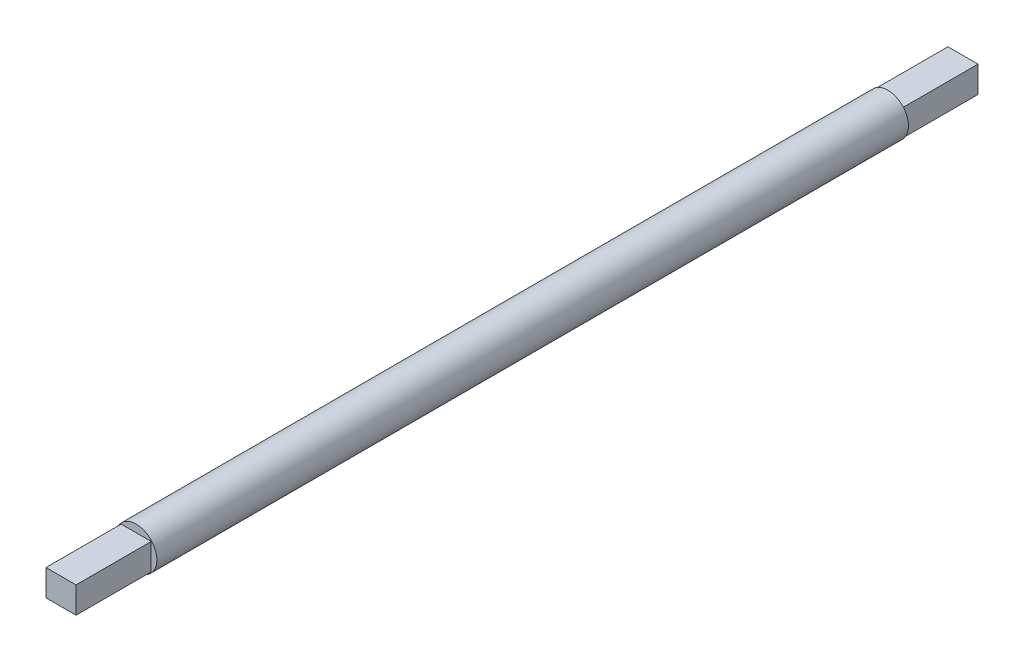
from build123d import *

# Parameters (mm, degrees)
SKETCH1_R           = 2.75
BOSS_EXTRUDE1_DEPTH = 100
SKETCH3_W           = 4
SKETCH3_H           = 3.5
BOSS_EXTRUDE2_DEPTH = 10
SKETCH4_W           = 4
SKETCH4_H           = 3.5
BOSS_EXTRUDE3_DEPTH = 10


with BuildPart() as part:
    # Sketch1 → Boss-Extrude1 (new body)
    with BuildSketch(Plane.XY):
        Circle(SKETCH1_R)
    extrude(amount=BOSS_EXTRUDE1_DEPTH)

    # Sketch3 → Boss-Extrude2 (add)
    with BuildSketch(Plane.XY.offset(100)):
        Rectangle(SKETCH3_W, SKETCH3_H)
    extrude(amount=BOSS_EXTRUDE2_DEPTH)

    # Sketch4 → Boss-Extrude3 (add)
    with BuildSketch(Plane(origin=(0, 0, 0), x_dir=(-1, 0, 0), z_dir=(0, 0, -1))):
        Rectangle(SKETCH4_W, SKETCH4_H)
    extrude(amount=BOSS_EXTRUDE3_DEPTH)


solid = part.part
